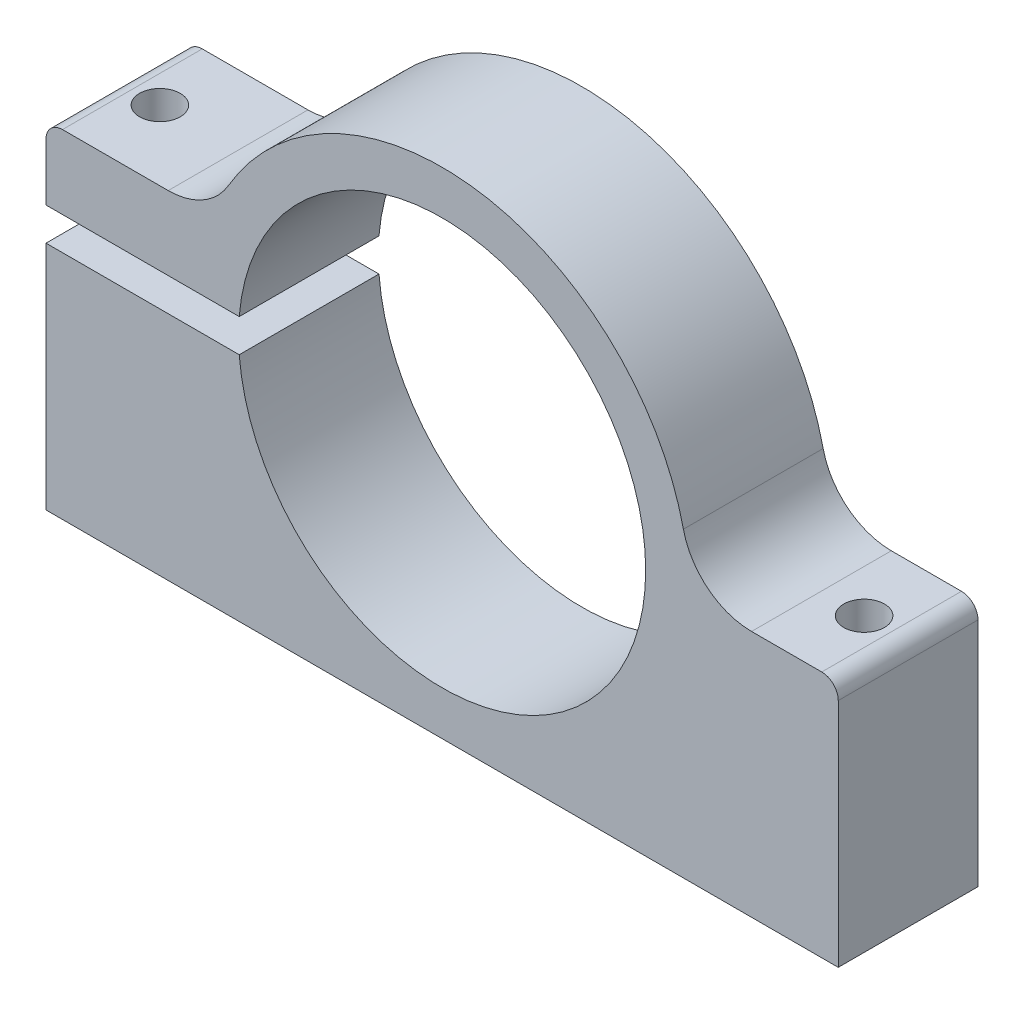
from build123d import *

# Parameters (mm, degrees)
BOSS_EXTRUDE1_DEPTH            = 12.7
CUT_EXTRUDE1_DEPTH             = 54.796151287
SKETCH3_W                      = 18.5
SKETCH3_H                      = 12.7
F_3_7_3_7_DIAMETER_HOLE1_D     = 3.7
SKETCH6_W                      = 1.85
SKETCH6_H                      = 20.98
F_3_7_3_7_DIAMETER_HOLE3_D     = 3.7
F_3_7_3_7_DIAMETER_HOLE3_DEPTH = 44.98
FILLET1_R                      = 1.5
FILLET2_R                      = 6.35


with BuildPart() as part:
    # Sketch1 → Boss-Extrude1 (new body)
    with BuildSketch(Plane(origin=(0, 0, -12.299495873), x_dir=(-1, 0, 0), z_dir=(0, 0, -1))):
        with BuildLine():
            Line((24.859325054, -22.385915399), (24.859325054, 8.305102167))
            Line((24.859325054, 8.305102167), (9.793928734, 8.305102167))
            ThreePointArc((9.793928734, 8.305102167), (-15.308438691, 22.204357242), (-33.620674946, 0.114084601))
            Line((-33.620674946, 0.114084601), (-47.140674946, 0.114084601))
            Line((-47.140674946, 0.114084601), (-47.140674946, -22.385915399))
            Line((-47.140674946, -22.385915399), (24.859325054, -22.385915399))
        make_face()
    extrude(amount=-BOSS_EXTRUDE1_DEPTH)

    # Sketch2 → Cut-Extrude1 (cut, through all)
    with BuildSketch(Plane.XY.offset(0.400504127)):
        with BuildLine():
            Line((-24.859325054, 1.614084601), (-24.859325054, -1.385915399))
            Line((-24.859325054, -1.385915399), (-7.298413969, -1.385915399))
            ThreePointArc((-7.298413969, -1.385915399), (-7.359325054, 0.114084601), (-7.298413969, 1.614084601))
            Line((-7.298413969, 1.614084601), (-24.859325054, 1.614084601))
        make_face()
    extrude(amount=-CUT_EXTRUDE1_DEPTH, mode=Mode.SUBTRACT)

    # Sketch3 → Cut-Revolve1 (revolve, cut)
    with BuildSketch(Plane.XZ.offset(-0.114084601)):
        with Locations((20.390674946, -5.949495873)):
            Rectangle(SKETCH3_W, SKETCH3_H)
    revolve(axis=Axis((11.140674946, 0.114084601, 0.400504127), (0, 0, -1)), mode=Mode.SUBTRACT)

    # Ø3.7 (3.7) Diameter Hole1 (through all)
    with Locations(Plane(origin=(0, 0.114084601, 0), x_dir=(1, 0, 0), z_dir=(0, 1, 0))):
        with Locations((43.140674946, 5.949495873)):
            Hole(F_3_7_3_7_DIAMETER_HOLE1_D / 2)

    # Sketch6 → Ø3.7 (3.7) Diameter Hole2 (revolve, cut)
    with BuildSketch(Plane(origin=(-20.859325054, 1.614084601, -5.949495873), x_dir=(0, 0, -1), z_dir=(1, 0, 0))):
        with Locations((0.925, 10.49)):
            Rectangle(SKETCH6_W, SKETCH6_H)
    revolve(axis=Axis((-20.859325054, -4.735915399, -5.949495873), (0, 1, 0)), mode=Mode.SUBTRACT)

    # Ø3.7 (3.7) Diameter Hole3
    with Locations(Plane(origin=(0, -22.385915399, 0), x_dir=(-1, 0, 0), z_dir=(0, -1, 0))):
        with Locations((20.859325054, 5.949495873)):
            Hole(F_3_7_3_7_DIAMETER_HOLE3_D / 2, depth=F_3_7_3_7_DIAMETER_HOLE3_DEPTH)

    # Fillet1
    fillet1_edges = [part.edges().sort_by_distance(p)[0] for p in [
        (47.140674946, 0.114084601, -5.949495873),
        (-24.859325054, 8.305102167, -5.949495873),
    ]]
    fillet(fillet1_edges, radius=FILLET1_R)

    # Fillet2
    fillet2_edges = [part.edges().sort_by_distance(p)[0] for p in [
        (33.620674946, 0.114084601, -5.949495873),
        (-9.793928734, 8.305102167, -5.949495873),
    ]]
    fillet(fillet2_edges, radius=FILLET2_R)


solid = part.part
